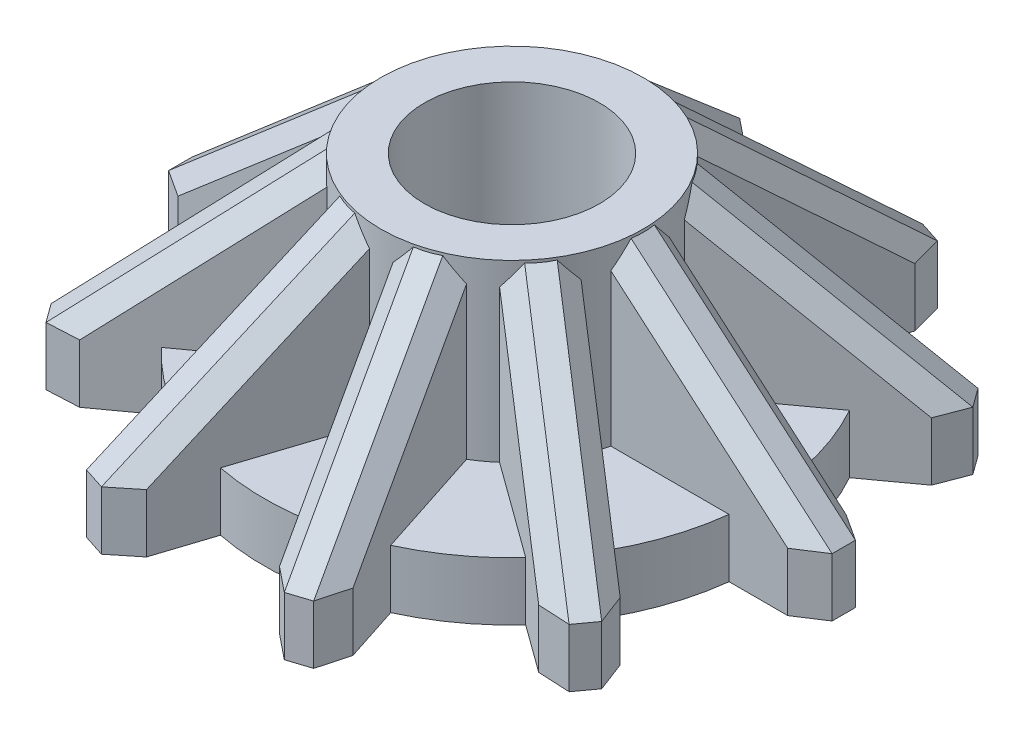
from build123d import *

# Parameters (mm, degrees)
SKETCH1_R                    = 5.75
BOSS_EXTRUDE1_DEPTH          = 1
SKETCH2_R                    = 2.25
BOSS_EXTRUDE2_DEPTH          = 3
RIB2_REACH                   = 11.062
SKETCH3_WALL_W               = 24.654296494
SKETCH3_WALL_H               = 1
CHAMFER1_SIZE                = 0.3
CIRPATTERN1_COUNT            = 10
CHAMFER1_OF_CIRPATTERN1_SIZE = 0.3
SKETCH5_R                    = 2.5
BOSS_EXTRUDE4_DEPTH          = 0.5
SKETCH6_R                    = 1.5
CUT_EXTRUDE1_DEPTH           = 10.293815148
CUT_EXTRUDE2_DEPTH           = 9.667467912
CIRPATTERN2_COUNT            = 10


with BuildPart() as part:
    # Sketch1 → Boss-Extrude1 (new body)
    with BuildSketch(Plane(origin=(0, 0, 0), x_dir=(1, 0, 0), z_dir=(0, 1, 0))):
        with Locations(Location((0, 0, 0), (0, 0, 270))):
            Circle(SKETCH1_R)
    extrude(amount=BOSS_EXTRUDE1_DEPTH)

    # Sketch2 → Boss-Extrude2 (add)
    with BuildSketch(Plane(origin=(0, 1, 0), x_dir=(1, 0, 0), z_dir=(0, 1, 0))):
        with Locations(Location((0, 0, 0), (0, 0, 270))):
            Circle(SKETCH2_R)
    extrude(amount=BOSS_EXTRUDE2_DEPTH)

    # Sketch3 wall → Rib2 (add, up to next)
    with BuildSketch(Plane(origin=(-3.968577633, 2.475160602, 0), x_dir=(-0.758799561347, -0.651324209361, 0), z_dir=(0.651324209361, -0.758799561347, 0)), mode=Mode.PRIVATE) as rib2_sk1:
        Rectangle(SKETCH3_WALL_W, SKETCH3_WALL_H)
    rib2_tool1 = extrude(rib2_sk1.sketch, amount=RIB2_REACH, mode=Mode.PRIVATE) - part.part
    rib2 = rib2_tool1.solids().sort_by_distance((-3.968577633, 2.475160602, 0))[0]
    add(rib2)

    # Chamfer1
    chamfer1_edges = [part.edges().sort_by_distance(p)[0] for p in [
        (-3.940448181, 2.499305836, -0.5),
        (-3.940448181, 2.499305836, 0.5),
    ]]
    chamfer(chamfer1_edges, length=CHAMFER1_SIZE)

    # CirPattern1: Rib2 ×10 about axis
    cirpattern1_axis = Axis((0, 0, 0), (0, 1, 0))
    for i in range(1, CIRPATTERN1_COUNT):
        add(rib2.rotate(cirpattern1_axis, i * 360 / CIRPATTERN1_COUNT))

    # Chamfer1 of CirPattern1
    chamfer1_of_cirpattern1_edges = [part.edges().sort_by_distance(p)[0] for p in [
        (-3.48178217, 2.499305836, 1.911628831),
        (-2.893996918, 2.499305836, 2.720645826),
        (-1.693193712, 2.499305836, 3.593080423),
        (-0.742137195, 2.499305836, 3.902097417),
        (0.742137195, 2.499305836, 3.902097417),
        (1.693193712, 2.499305836, 3.593080423),
        (2.893996918, 2.499305836, 2.720645826),
        (3.48178217, 2.499305836, 1.911628831),
        (3.940448181, 2.499305836, 0.5),
        (3.940448181, 2.499305836, -0.5),
        (3.48178217, 2.499305836, -1.911628831),
        (2.893996918, 2.499305836, -2.720645826),
        (1.693193712, 2.499305836, -3.593080423),
        (0.742137195, 2.499305836, -3.902097417),
        (-0.742137195, 2.499305836, -3.902097417),
        (-1.693193712, 2.499305836, -3.593080423),
        (-2.893996918, 2.499305836, -2.720645826),
        (-3.48178217, 2.499305836, -1.911628831),
    ]]
    chamfer(chamfer1_of_cirpattern1_edges, length=CHAMFER1_OF_CIRPATTERN1_SIZE)

    # Sketch5 → Boss-Extrude4 (add)
    with BuildSketch(Plane.XZ):
        with Locations(Location((0, 0, 0), (0, 0, 270))):
            Circle(SKETCH5_R)
    extrude(amount=BOSS_EXTRUDE4_DEPTH)

    # Sketch6 → Cut-Extrude1 (cut, through all)
    with BuildSketch(Plane(origin=(0, 4, 0), x_dir=(1, 0, 0), z_dir=(0, 1, 0))):
        with Locations(Location((0, 0, 0), (0, 0, 270))):
            Circle(SKETCH6_R)
    extrude(amount=-CUT_EXTRUDE1_DEPTH, mode=Mode.SUBTRACT)

    # Sketch8 → Cut-Extrude2 (cut, through all)
    with BuildSketch(Plane(origin=(0, 1, 0), x_dir=(1, 0, 0), z_dir=(0, 1, 0))):
        with BuildLine():
            Line((-1.94763893, -5.347002675), (-1.567216323, -5.470609473))
            Line((-1.567216323, -5.470609473), (-1.139566108, -5.125257839))
            Line((-1.139566108, -5.125257839), (-0.828673564, -4.168428975))
            ThreePointArc((-0.828673564, -4.168428975), (0, -4.25), (0.828673564, -4.168428975))
            Line((0.828673564, -4.168428975), (1.139566108, -5.125257839))
            Line((1.139566108, -5.125257839), (1.567216323, -5.470609473))
            Line((1.567216323, -5.470609473), (1.649704909, -5.578945165))
            Line((1.649704909, -5.578945165), (0.683984218, -7.712906306))
            Line((0.683984218, -7.712906306), (-2.388981324, -6.322240681))
            Line((-2.388981324, -6.322240681), (-1.94763893, -5.347002675))
        make_face()
    cut_extrude2 = extrude(amount=-CUT_EXTRUDE2_DEPTH, mode=Mode.SUBTRACT)

    # CirPattern2: Cut-Extrude2 ×10 about axis
    cirpattern2_axis = Axis((0, 0, 0), (0, 1, 0))
    for i in range(1, CIRPATTERN2_COUNT):
        add(cut_extrude2.rotate(cirpattern2_axis, i * 360 / CIRPATTERN2_COUNT), mode=Mode.SUBTRACT)


solid = part.part
